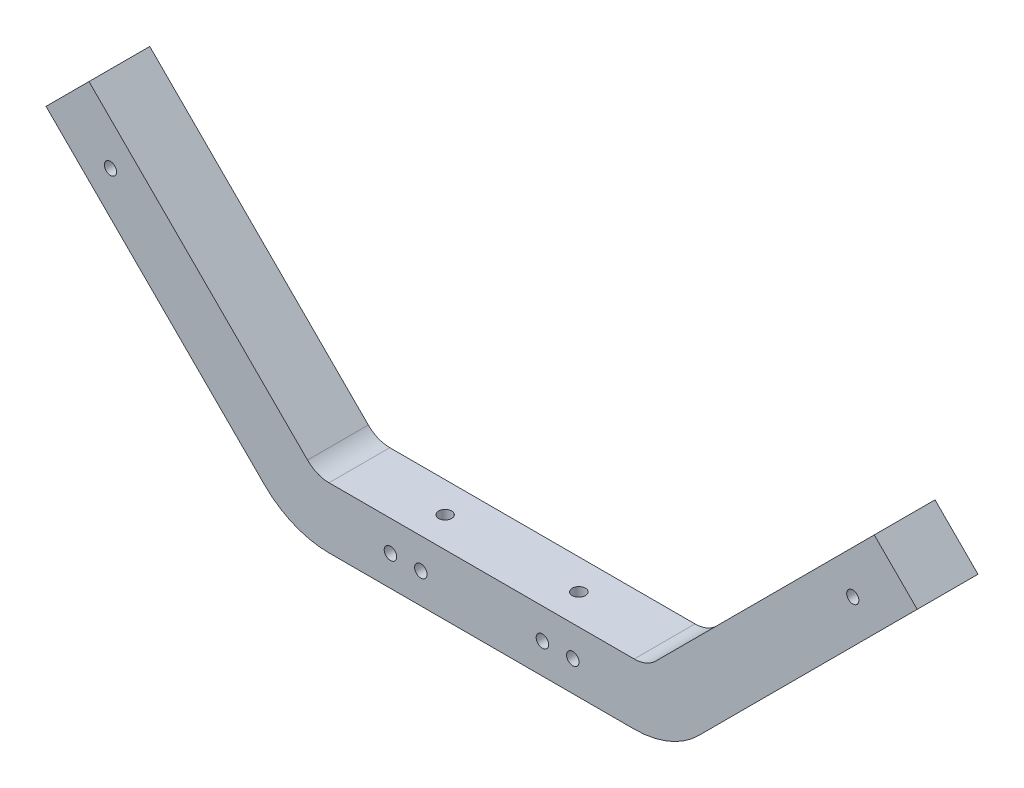
from build123d import *

# Parameters (mm, degrees)
SKETCH_1_R          = 2
EXTRUDE_1_DEPTH     = 20
FILLET_1_R          = 10
FILLET_2_R          = 30
SKETCH_2_R          = 2.05
CUT_EXTRUDE_1_DEPTH = 50
SKETCH_3_R          = 5
CUT_EXTRUDE_2_DEPTH = 5
SKETCH_4_R          = 2.05
CUT_EXTRUDE_3_DEPTH = 29
SKETCH_5_R          = 2.15
CUT_EXTRUDE_4_DEPTH = 29


with BuildPart() as part:
    # 草图1 → 凸台-拉伸1 (new body)
    with BuildSketch(Plane.XY):
        Polygon((-143.355339059, 70.710678119), (-129.213203436, 84.852813742), (-54.360389693, 10), (54.360389693, 10), (129.213203436, 84.852813742), (143.355339059, 70.710678119), (62.644660941, -10), (-62.644660941, -10), align=None)
        with Locations((-122.142135624, 63.639610307)):
            Circle(SKETCH_1_R, mode=Mode.SUBTRACT)
        with Locations((122.142135624, 63.639610307)):
            Circle(SKETCH_1_R, mode=Mode.SUBTRACT)
    extrude(amount=EXTRUDE_1_DEPTH)

    # 圆角1
    fillet_1_edges = [part.edges().sort_by_distance(p)[0] for p in [
        (-54.360389693, 10, 10),
        (54.360389693, 10, 10),
    ]]
    fillet(fillet_1_edges, radius=FILLET_1_R)

    # 圆角2
    fillet_2_edges = [part.edges().sort_by_distance(p)[0] for p in [
        (62.644660941, -10, 10),
        (-62.644660941, -10, 10),
    ]]
    fillet(fillet_2_edges, radius=FILLET_2_R)

    # 草图2 → 切除-拉伸1 (cut)
    with BuildSketch(Plane.XY.offset(20)):
        with Locations((-30, 0)):
            Circle(SKETCH_2_R)
        with Locations((30, 0)):
            Circle(SKETCH_2_R)
    extrude(amount=-CUT_EXTRUDE_1_DEPTH, mode=Mode.SUBTRACT)

    # 草图3 → 切除-拉伸2 (cut)
    with BuildSketch(Plane(origin=(0, 0, 0), x_dir=(-1, 0, 0), z_dir=(0, 0, -1))):
        with Locations((-30, 0)):
            Circle(SKETCH_3_R)
        with Locations((30, 0)):
            Circle(SKETCH_3_R)
    extrude(amount=-CUT_EXTRUDE_2_DEPTH, mode=Mode.SUBTRACT)

    # 草图4 → 切除-拉伸3 (cut)
    with BuildSketch(Plane(origin=(0, 0, 0), x_dir=(-1, 0, 0), z_dir=(0, 0, -1))):
        with Locations((-20, 0)):
            Circle(SKETCH_4_R)
        with Locations((20, 0)):
            Circle(SKETCH_4_R)
    extrude(amount=-CUT_EXTRUDE_3_DEPTH, mode=Mode.SUBTRACT)

    # 草图5 → 切除-拉伸4 (cut)
    with BuildSketch(Plane.XZ.offset(10)):
        with Locations((-22, 10)):
            Circle(SKETCH_5_R)
        with Locations((22, 10)):
            Circle(SKETCH_5_R)
    extrude(amount=-CUT_EXTRUDE_4_DEPTH, mode=Mode.SUBTRACT)


solid = part.part
